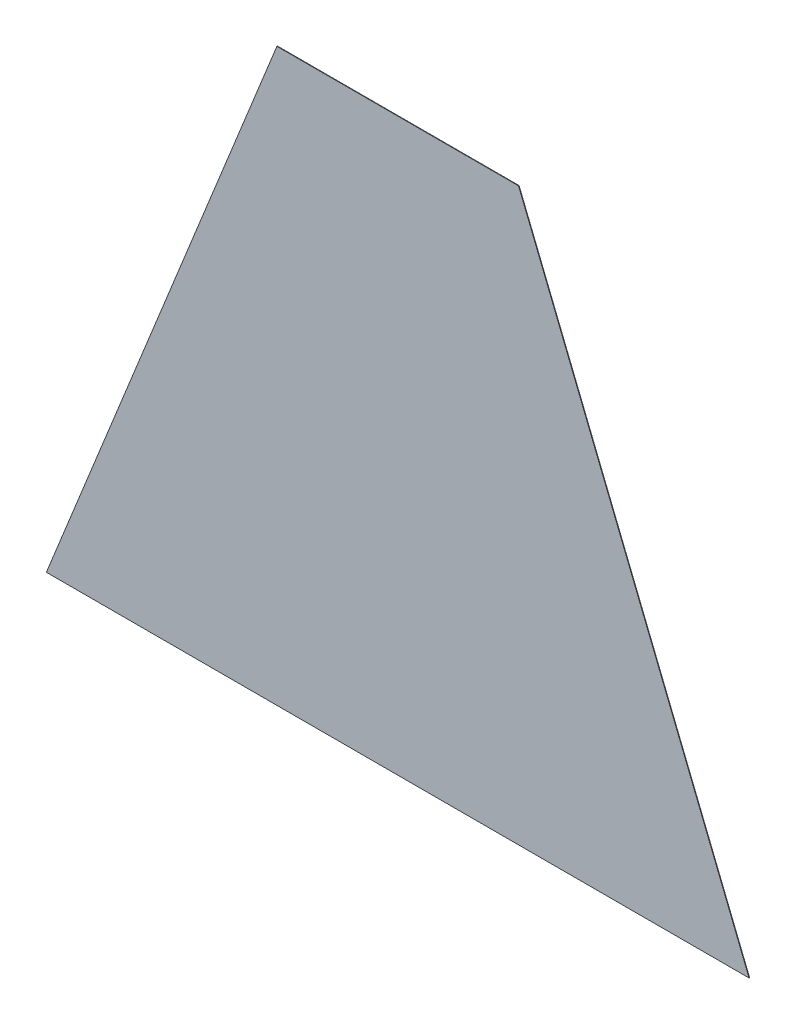
from build123d import *

# Parameters (mm, degrees)
BOSS_EXTRUDE1_DEPTH = 2.54


with BuildPart() as part:
    # Sketch1 → Boss-Extrude1 (new body)
    with BuildSketch(Plane.XY):
        Polygon((-15.675470623, 3910.728570059), (-1109.414561326, 1202.765038925), (2224.581782136, 1202.765038925), (1130.842691433, 3910.728570059), align=None)
    extrude(amount=BOSS_EXTRUDE1_DEPTH)


solid = part.part
